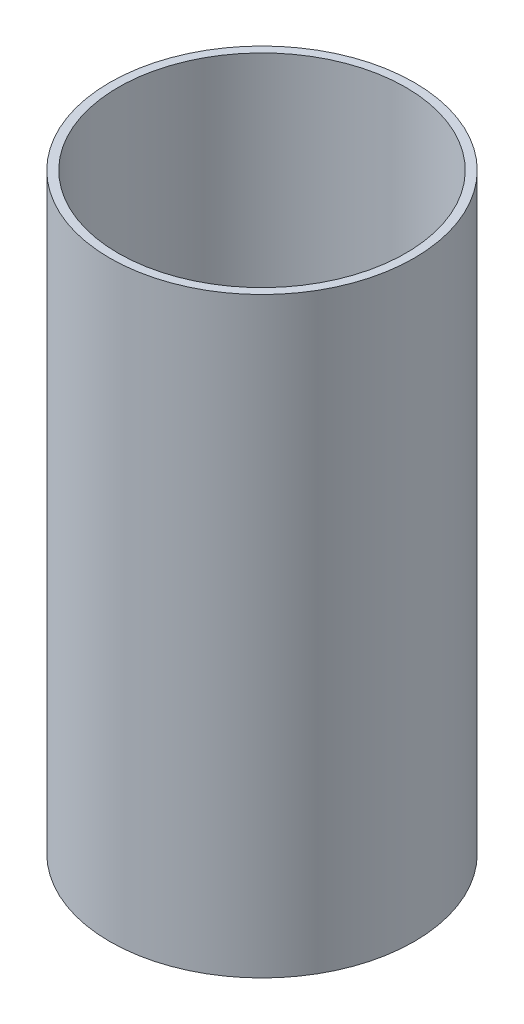
from build123d import *

# Parameters (mm, degrees)
SKETCH1_R           = 27
SKETCH1_R_2         = 25.5
BOSS_EXTRUDE1_DEPTH = 105


with BuildPart() as part:
    # Sketch1 → Boss-Extrude1 (new body)
    with BuildSketch(Plane(origin=(0, 0, 0), x_dir=(1, 0, 0), z_dir=(0, 1, 0))):
        with Locations(Location((0, 0, 0), (0, 0, 270))):
            Circle(SKETCH1_R)
        with Locations(Location((0, 0, 0), (0, 0, 270))):
            Circle(SKETCH1_R_2, mode=Mode.SUBTRACT)
    extrude(amount=BOSS_EXTRUDE1_DEPTH)


solid = part.part
